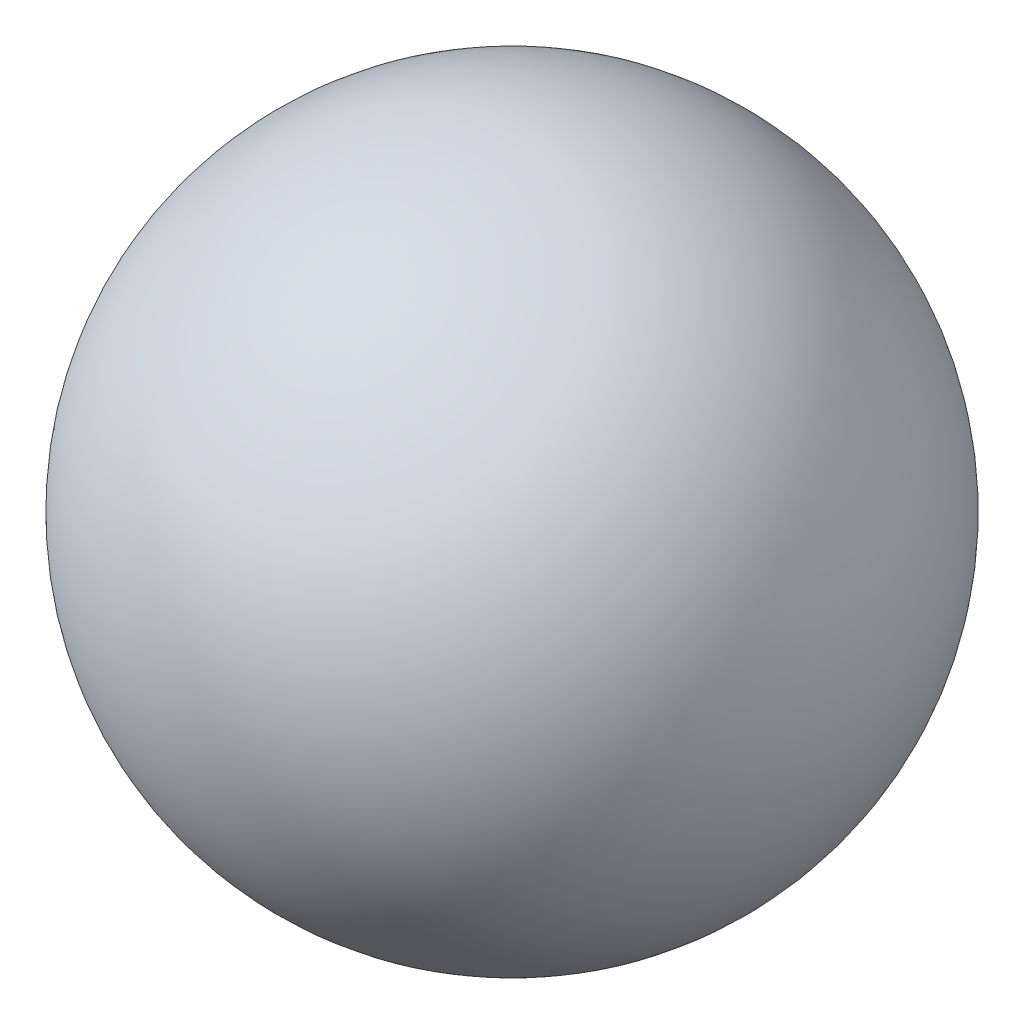
from build123d import *


with BuildPart() as part:
    # Sketch1 → Revolve1 (revolve)
    with BuildSketch(Plane.XY):
        with BuildLine():
            Line((0, 21.335), (0, -21.335))
            ThreePointArc((0, -21.335), (21.335, 0), (0, 21.335))
        make_face()
    revolve(axis=Axis((0, 21.335, 0), (0, -1, 0)))


solid = part.part
